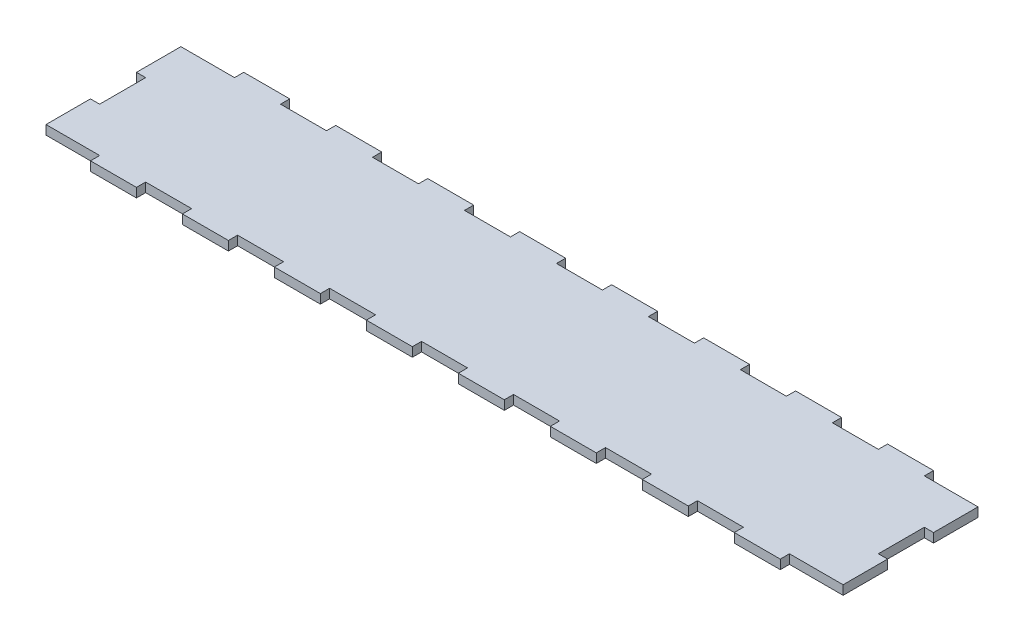
from build123d import *

# Parameters (mm, degrees)
SALIENTE_EXTRUIR1_DEPTH = 3


with BuildPart() as part:
    # Croquis1 → Saliente-Extruir1 (new body)
    with BuildSketch(Plane(origin=(0, 0, 0), x_dir=(1, 0, 0), z_dir=(0, 1, 0))):
        Polygon((17.5, 0), (32.5, 0), (32.5, 3), (47.5, 3), (47.5, 0), (62.5, 0), (62.5, 3), (77.5, 3), (77.5, 0), (92.5, 0), (92.5, 3), (107.5, 3), (107.5, 0), (122.5, 0), (122.5, 3), (137.5, 3), (137.5, 0), (152.5, 0), (152.5, 3), (167.5, 3), (167.5, 0), (182.5, 0), (182.5, 3), (197.5, 3), (197.5, 0), (212.5, 0), (212.5, 3), (227.5, 3), (227.5, 0), (242.5, 0), (242.5, 3), (260, 3), (260, 17.5), (257, 17.5), (257, 32.5), (260, 32.5), (260, 47), (242.5, 47), (242.5, 50), (227.5, 50), (227.5, 47), (212.5, 47), (212.5, 50), (197.5, 50), (197.5, 47), (182.5, 47), (182.5, 50), (167.5, 50), (167.5, 47), (152.5, 47), (152.5, 50), (137.5, 50), (137.5, 47), (122.5, 47), (122.5, 50), (107.5, 50), (107.5, 47), (92.5, 47), (92.5, 50), (77.5, 50), (77.5, 47), (62.5, 47), (62.5, 50), (47.5, 50), (47.5, 47), (32.5, 47), (32.5, 50), (17.5, 50), (17.5, 47), (0, 47), (0, 32.5), (3, 32.5), (3, 17.5), (0, 17.5), (0, 3), (17.5, 3), align=None)
    extrude(amount=SALIENTE_EXTRUIR1_DEPTH)


solid = part.part
